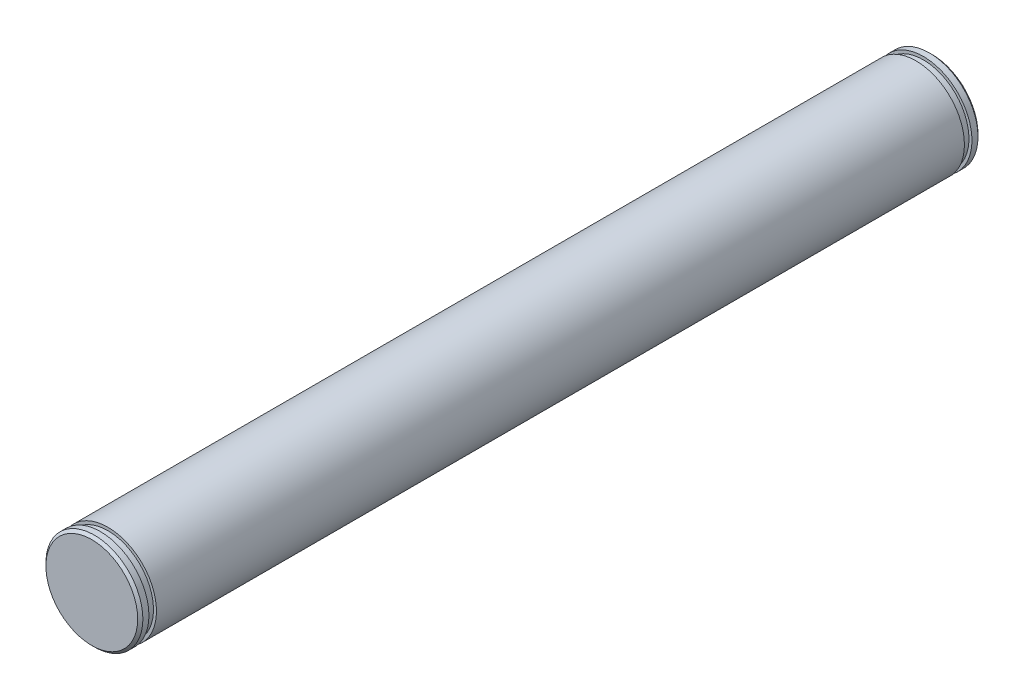
from build123d import *

# Parameters (mm, degrees)
SKETCH1_R           = 4.7625
BOSS_EXTRUDE1_DEPTH = 41.275
SKETCH2_W           = 0.7366
SKETCH2_H           = 2.54
CHAMFER1_SIZE       = 0.254


with BuildPart() as part:
    # Sketch1 → Boss-Extrude1 (new, symmetric)
    with BuildSketch(Plane.XY):
        Circle(SKETCH1_R)
    extrude(amount=BOSS_EXTRUDE1_DEPTH, both=True)

    # Sketch2 → Cut-Revolve1 (revolve, cut)
    with BuildSketch(Plane(origin=(0, 0, 0), x_dir=(0, 0, -1), z_dir=(1, 0, 0)), mode=Mode.PRIVATE) as cut_revolve1_sk:
        with Locations((-40.0558, 5.7404)):
            Rectangle(SKETCH2_W, SKETCH2_H)
    cut_revolve1 = revolve(cut_revolve1_sk.sketch.rotate(Axis((0, 0, 0), (0, 0, 1)), 90), axis=Axis((0, 0, 0), (0, 0, 1)), mode=Mode.SUBTRACT)

    # Chamfer1
    chamfer1_edges = [part.edges().sort_by_distance(p)[0] for p in [
        (-4.7625, 0, -41.275),
        (-4.7625, 0, 41.275),
    ]]
    chamfer(chamfer1_edges, length=CHAMFER1_SIZE)

    # Mirror3: Cut-Revolve1 across plane
    add(cut_revolve1.mirror(Plane.XY), mode=Mode.SUBTRACT)


solid = part.part
